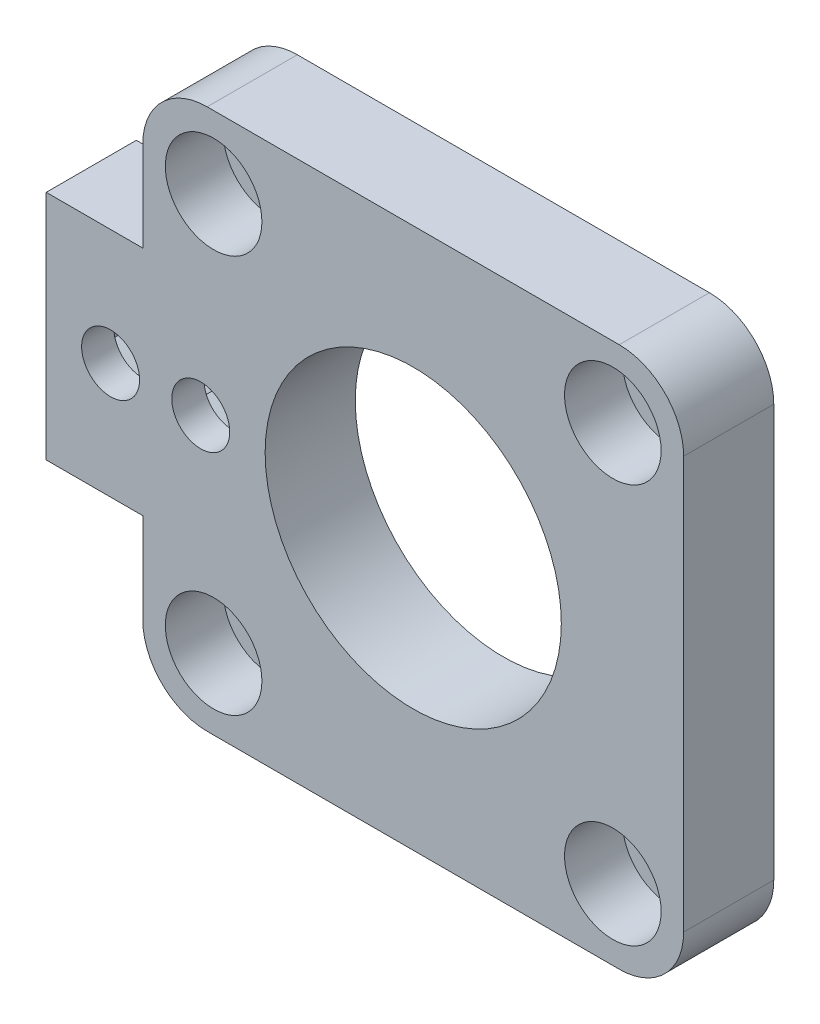
from build123d import *

# Parameters (mm, degrees)
ESQUISSE1_W             = 42
ESQUISSE1_H             = 42
ESQUISSE1_R             = 11.5
ESQUISSE1_R_2           = 1.75
ESQUISSE1_W_2           = 7.5
ESQUISSE1_H_2           = 18
BOSS_EXTRU_1_DEPTH      = 7
ESQUISSE9_R             = 2.25
ENL_V_MAT_EXTRU_2_DEPTH = 17
ENL_V_MAT_EXTRU_3_DEPTH = 4.5
ESQUISSE11_R            = 3.75
ENL_V_MAT_EXTRU_4_DEPTH = 4.5
CONG_1_R                = 5


with BuildPart() as part:
    # Esquisse1 → Boss.-Extru.1 (new body)
    # profile 1 of 2: a face of its own
    with BuildSketch(Plane.XY):
        with Locations((-21, -21)):
            Rectangle(ESQUISSE1_W, ESQUISSE1_H)
        with Locations((-21, -21)):
            Circle(ESQUISSE1_R, mode=Mode.SUBTRACT)
        with Locations((-36.5, -36.5)):
            Circle(ESQUISSE1_R_2, mode=Mode.SUBTRACT)
        with Locations((-5.5, -36.5)):
            Circle(ESQUISSE1_R_2, mode=Mode.SUBTRACT)
        with Locations((-5.5, -5.5)):
            Circle(ESQUISSE1_R_2, mode=Mode.SUBTRACT)
        with Locations((-36.5, -5.611040912)):
            Circle(ESQUISSE1_R_2, mode=Mode.SUBTRACT)
    # profile 2 of 2: a face of its own
    with BuildSketch(Plane.XY):
        with Locations((-45.75, -21)):
            Rectangle(ESQUISSE1_W_2, ESQUISSE1_H_2)
    extrude(amount=BOSS_EXTRU_1_DEPTH)

    # Esquisse9 → Enlèv. mat.-Extru.2 (cut)
    with BuildSketch(Plane.XY.offset(7)):
        with Locations((-44.5, -21)):
            Circle(ESQUISSE9_R)
        with Locations((-37.5, -21)):
            Circle(ESQUISSE9_R)
    extrude(amount=-ENL_V_MAT_EXTRU_2_DEPTH, mode=Mode.SUBTRACT)

    # Esquisse10 → Enlèv. mat.-Extru.3 (cut)
    with BuildSketch(Plane(origin=(0, 0, 0), x_dir=(-1, 0, 0), z_dir=(0, 0, -1))):
        Polygon((44.5, -25.330127019), (48.25, -23.165063509), (48.25, -18.834936491), (44.5, -16.669872981), (40.75, -18.834936491), (40.75, -23.165063509), align=None)
        Polygon((37.5, -25.330127019), (41.25, -23.165063509), (41.25, -18.834936491), (37.5, -16.669872981), (33.75, -18.834936491), (33.75, -23.165063509), align=None)
    extrude(amount=-ENL_V_MAT_EXTRU_3_DEPTH, mode=Mode.SUBTRACT)

    # Esquisse11 → Enlèv. mat.-Extru.4 (cut)
    with BuildSketch(Plane.XY.offset(7)):
        with Locations((-36.5, -5.611040912)):
            Circle(ESQUISSE11_R)
        with Locations((-5.5, -5.5)):
            Circle(ESQUISSE11_R)
        with Locations((-5.5, -36.5)):
            Circle(ESQUISSE11_R)
        with Locations((-36.5, -36.5)):
            Circle(ESQUISSE11_R)
    extrude(amount=-ENL_V_MAT_EXTRU_4_DEPTH, mode=Mode.SUBTRACT)

    # Congé1
    cong_1_edges = [part.edges().sort_by_distance(p)[0] for p in [
        (0, 0, 3.5),
        (0, -42, 3.5),
        (-42, -42, 3.5),
        (-42, 0, 3.5),
    ]]
    fillet(cong_1_edges, radius=CONG_1_R)


solid = part.part
